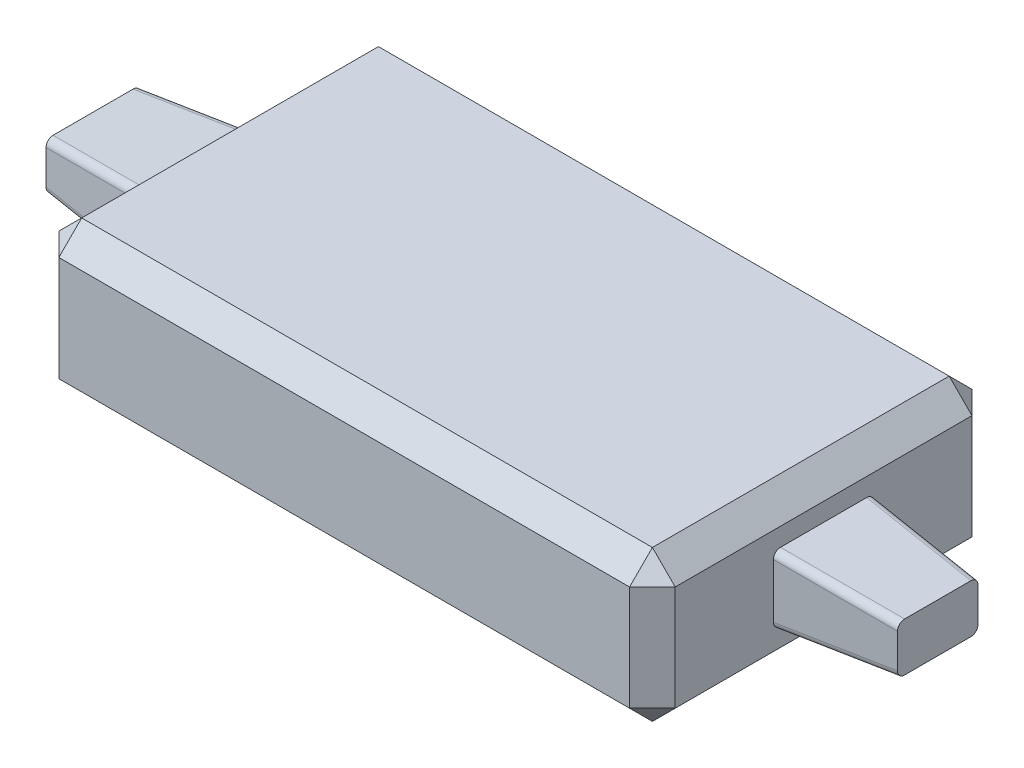
from build123d import *

# Parameters (mm, degrees)
SKETCH1_W           = 34.29
SKETCH1_H           = 19.05
BOSS_EXTRUDE1_DEPTH = 8.382
SKETCH2_R           = 2.286
BOSS_EXTRUDE2_DEPTH = 1.27
SKETCH3_W           = 6.35
SKETCH3_H           = 3.81
BOSS_EXTRUDE3_DEPTH = 6.35
BOSS_EXTRUDE3_TAPER = 5
SKETCH4_W           = 5.588
SKETCH4_H           = 3.81
BOSS_EXTRUDE4_DEPTH = 6.35
BOSS_EXTRUDE4_TAPER = 5
CHAMFER1_SIZE       = 1.27
FILLET1_R           = 0.396875
FILLET2_R           = 0.396875


with BuildPart() as part:
    # Sketch1 → Boss-Extrude1 (new body)
    with BuildSketch(Plane(origin=(0, 0, 0), x_dir=(1, 0, 0), z_dir=(0, 1, 0))):
        Rectangle(SKETCH1_W, SKETCH1_H)
    extrude(amount=BOSS_EXTRUDE1_DEPTH)

    # Sketch2 → Boss-Extrude2 (add)
    with BuildSketch(Plane(origin=(0, 0, 0), x_dir=(-1, 0, 0), z_dir=(0, -1, 0))):
        with Locations(Location((5.715, 0, 0), (0, 0, 90))):
            Circle(SKETCH2_R)
        with Locations(Location((-5.715, 0, 0), (0, 0, 90))):
            Circle(SKETCH2_R)
    extrude(amount=BOSS_EXTRUDE2_DEPTH)

    # Chamfer1
    chamfer1_edges = [part.edges().sort_by_distance(p)[0] for p in [
        (-17.145, 8.382, 0),
        (0, 8.382, 9.525),
        (17.145, 8.382, 0),
        (0, 0, 9.525),
        (-17.145, 0, 0),
        (0, 0, -9.525),
        (17.145, 0, 0),
        (0, 8.382, -9.525),
        (17.145, 4.191, 9.525),
        (-17.145, 4.191, 9.525),
        (-17.145, 4.191, -9.525),
        (17.145, 4.191, -9.525),
    ]]
    chamfer(chamfer1_edges, length=CHAMFER1_SIZE)


with BuildPart() as body_2:
    # Sketch3 → Boss-Extrude3 (new body)
    with BuildSketch(Plane.ZY.offset(17.145)):
        with Locations((0, 4.191)):
            Rectangle(SKETCH3_W, SKETCH3_H)
    extrude(amount=BOSS_EXTRUDE3_DEPTH, taper=BOSS_EXTRUDE3_TAPER)

    # Fillet2
    fillet2_edges = [body_2.edges().sort_by_distance(p)[0] for p in [
        (-20.32, 2.563776507, 2.897223493),
        (-20.32, 2.563776507, -2.897223493),
        (-20.32, 5.818223493, -2.897223493),
        (-20.32, 5.818223493, 2.897223493),
    ]]
    fillet(fillet2_edges, radius=FILLET2_R)


with BuildPart() as body_3:
    # Sketch4 → Boss-Extrude4 (new body)
    with BuildSketch(Plane(origin=(17.145, 0, 0), x_dir=(0, 0, -1), z_dir=(1, 0, 0))):
        with Locations((0, 4.191)):
            Rectangle(SKETCH4_W, SKETCH4_H)
    extrude(amount=BOSS_EXTRUDE4_DEPTH, taper=BOSS_EXTRUDE4_TAPER)

    # Fillet1
    fillet1_edges = [body_3.edges().sort_by_distance(p)[0] for p in [
        (20.32, 2.563776507, -2.516223493),
        (20.32, 2.563776507, 2.516223493),
        (20.32, 5.818223493, 2.516223493),
        (20.32, 5.818223493, -2.516223493),
    ]]
    fillet(fillet1_edges, radius=FILLET1_R)


solid = Compound([part.part, body_2.part, body_3.part])
